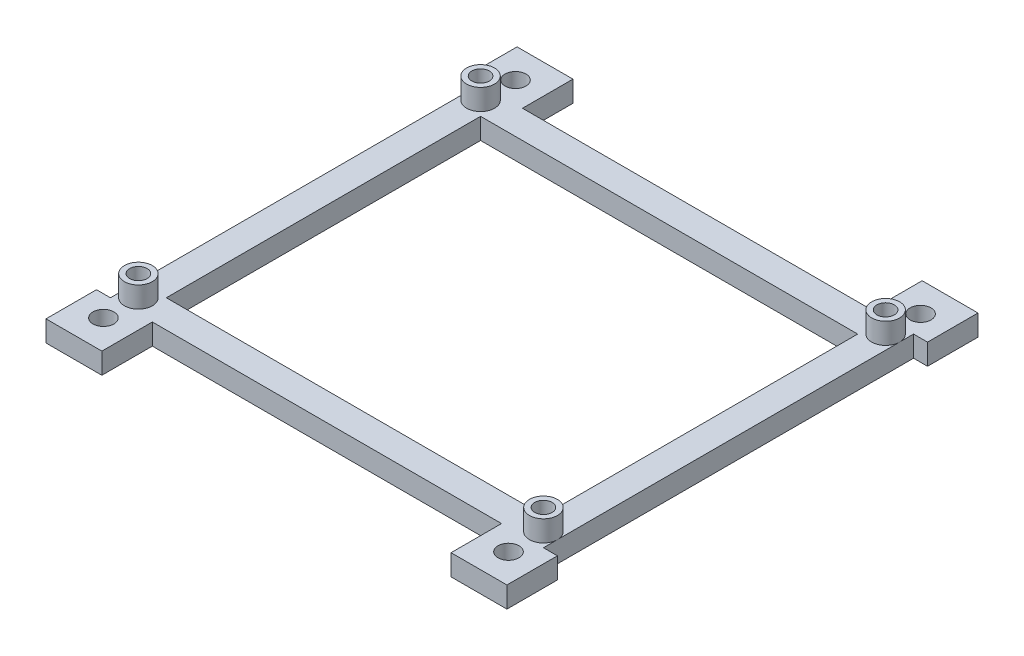
from build123d import *
from build123d.topology import SkipClean

# Parameters (mm, degrees)
SKETCH_1_R      = 2
SKETCH_1_R_2    = 1.25
EXTRUDE_1_DEPTH = 3
SKETCH_2_R      = 2
SKETCH_2_R_2    = 1.25
EXTRUDE_2_DEPTH = 3
SKETCH_3_R      = 1.5
EXTRUDE_3_DEPTH = 3
EXTRUDE_4_DEPTH = 3


with BuildPart() as part:
    # 草图1 → 凸台-拉伸1 (new body)
    # profile 1 of 12: a face of its own
    with BuildSketch(Plane(origin=(0, 0, 0), x_dir=(1, 0, 0), z_dir=(0, 1, 0))):
        with BuildLine():
            ThreePointArc((-27, -24.5), (-27.585786438, -25.914213562), (-29, -26.5))
            Line((-29, -26.5), (29, -26.5))
            ThreePointArc((29, -26.5), (27.585786438, -25.914213562), (27, -24.5))
            Line((27, -24.5), (27, -22.5))
            Line((27, -22.5), (-27, -22.5))
            Line((-27, -22.5), (-27, -24.5))
        make_face()
    # profile 2 of 12: a face of its own
    with BuildSketch(Plane(origin=(0, 0, 0), x_dir=(1, 0, 0), z_dir=(0, 1, 0))):
        with BuildLine():
            Line((29, -22.5), (27, -22.5))
            Line((27, -22.5), (27, -24.5))
            ThreePointArc((27, -24.5), (27.585786438, -23.085786438), (29, -22.5))
        make_face()
    # profile 3 of 12: a face of its own
    with BuildSketch(Plane(origin=(0, 0, 0), x_dir=(1, 0, 0), z_dir=(0, 1, 0))):
        with Locations((29, -24.5)):
            Circle(SKETCH_1_R)
        with Locations(Location((29, -24.5, 0), (0, 0, 270))):
            Circle(SKETCH_1_R_2, mode=Mode.SUBTRACT)
    # profile 4 of 12: a face of its own
    with BuildSketch(Plane(origin=(0, 0, 0), x_dir=(1, 0, 0), z_dir=(0, 1, 0))):
        with BuildLine():
            Line((31, -24.5), (31, 24.5))
            ThreePointArc((31, 24.5), (30.414213562, 23.085786438), (29, 22.5))
            Line((29, 22.5), (27, 22.5))
            Line((27, 22.5), (27, -22.5))
            Line((27, -22.5), (29, -22.5))
            ThreePointArc((29, -22.5), (30.414213562, -23.085786438), (31, -24.5))
        make_face()
    # profile 5 of 12: a face of its own
    with BuildSketch(Plane(origin=(0, 0, 0), x_dir=(1, 0, 0), z_dir=(0, 1, 0))):
        with BuildLine():
            ThreePointArc((-29, 22.5), (-30.414213562, 23.085786438), (-31, 24.5))
            Line((-31, 24.5), (-31, -24.5))
            ThreePointArc((-31, -24.5), (-30.414213562, -23.085786438), (-29, -22.5))
            Line((-29, -22.5), (-27, -22.5))
            Line((-27, -22.5), (-27, 22.5))
            Line((-27, 22.5), (-29, 22.5))
        make_face()
    # profile 6 of 12: a face of its own
    with BuildSketch(Plane(origin=(0, 0, 0), x_dir=(1, 0, 0), z_dir=(0, 1, 0))):
        with Locations((-29, -24.5)):
            Circle(SKETCH_1_R)
        with Locations(Location((-29, -24.5, 0), (0, 0, 270))):
            Circle(SKETCH_1_R_2, mode=Mode.SUBTRACT)
    # profile 7 of 12: a face of its own
    with BuildSketch(Plane(origin=(0, 0, 0), x_dir=(1, 0, 0), z_dir=(0, 1, 0))):
        with BuildLine():
            Line((-27, -22.5), (-29, -22.5))
            ThreePointArc((-29, -22.5), (-27.585786438, -23.085786438), (-27, -24.5))
            Line((-27, -24.5), (-27, -22.5))
        make_face()
    # profile 8 of 12: a face of its own
    with BuildSketch(Plane(origin=(0, 0, 0), x_dir=(1, 0, 0), z_dir=(0, 1, 0))):
        with BuildLine():
            ThreePointArc((29, 22.5), (27.585786438, 23.085786438), (27, 24.5))
            Line((27, 24.5), (27, 22.5))
            Line((27, 22.5), (29, 22.5))
        make_face()
    # profile 9 of 12: a face of its own
    with BuildSketch(Plane(origin=(0, 0, 0), x_dir=(1, 0, 0), z_dir=(0, 1, 0))):
        with Locations((29, 24.5)):
            Circle(SKETCH_1_R)
        with Locations(Location((29, 24.5, 0), (0, 0, 270))):
            Circle(SKETCH_1_R_2, mode=Mode.SUBTRACT)
    # profile 10 of 12: a face of its own
    with BuildSketch(Plane(origin=(0, 0, 0), x_dir=(1, 0, 0), z_dir=(0, 1, 0))):
        with BuildLine():
            Line((29, 26.5), (-29, 26.5))
            ThreePointArc((-29, 26.5), (-27.585786438, 25.914213562), (-27, 24.5))
            Line((-27, 24.5), (-27, 22.5))
            Line((-27, 22.5), (27, 22.5))
            Line((27, 22.5), (27, 24.5))
            ThreePointArc((27, 24.5), (27.585786438, 25.914213562), (29, 26.5))
        make_face()
    # profile 11 of 12: a face of its own
    with BuildSketch(Plane(origin=(0, 0, 0), x_dir=(1, 0, 0), z_dir=(0, 1, 0))):
        with BuildLine():
            ThreePointArc((-27, 24.5), (-27.585786438, 23.085786438), (-29, 22.5))
            Line((-29, 22.5), (-27, 22.5))
            Line((-27, 22.5), (-27, 24.5))
        make_face()
    # profile 12 of 12: a face of its own
    with BuildSketch(Plane(origin=(0, 0, 0), x_dir=(1, 0, 0), z_dir=(0, 1, 0))):
        with Locations((-29, 24.5)):
            Circle(SKETCH_1_R)
        with Locations(Location((-29, 24.5, 0), (0, 0, 270))):
            Circle(SKETCH_1_R_2, mode=Mode.SUBTRACT)
    extrude(amount=EXTRUDE_1_DEPTH)

    # 草图2 → 凸台-拉伸2 (add)
    # profile 1 of 4: a face of its own
    with SkipClean():  # the faces are left unmerged after this step: merging them gives an invalid solid
        with BuildSketch(Plane(origin=(0, 3, 0), x_dir=(1, 0, 0), z_dir=(0, 1, 0))):
            with Locations(Location((-29, 24.5, 0), (0, 0, 90))):
                Circle(SKETCH_2_R)
            with Locations(Location((-29, 24.5, 0), (0, 0, 270))):
                Circle(SKETCH_2_R_2, mode=Mode.SUBTRACT)
        # profile 2 of 4: a face of its own
        with BuildSketch(Plane(origin=(0, 3, 0), x_dir=(1, 0, 0), z_dir=(0, 1, 0))):
            with Locations(Location((29, 24.5, 0), (0, 0, 90))):
                Circle(SKETCH_2_R)
            with Locations(Location((29, 24.5, 0), (0, 0, 270))):
                Circle(SKETCH_2_R_2, mode=Mode.SUBTRACT)
        # profile 3 of 4: a face of its own
        with BuildSketch(Plane(origin=(0, 3, 0), x_dir=(1, 0, 0), z_dir=(0, 1, 0))):
            with Locations(Location((-29, -24.5, 0), (0, 0, 270))):
                Circle(SKETCH_2_R)
            with Locations(Location((-29, -24.5, 0), (0, 0, 270))):
                Circle(SKETCH_2_R_2, mode=Mode.SUBTRACT)
        # profile 4 of 4: a face of its own
        with BuildSketch(Plane(origin=(0, 3, 0), x_dir=(1, 0, 0), z_dir=(0, 1, 0))):
            with Locations(Location((29, -24.5, 0), (0, 0, 270))):
                Circle(SKETCH_2_R)
            with Locations(Location((29, -24.5, 0), (0, 0, 270))):
                Circle(SKETCH_2_R_2, mode=Mode.SUBTRACT)
        extrude(amount=EXTRUDE_2_DEPTH)

    # 草图3 → 凸台-拉伸3 (add)
    # profile 1 of 4: a face of its own
    with BuildSketch(Plane.XZ):
        with BuildLine():
            Line((-31, 24.5), (-31, 31.727166486))
            Line((-31, 31.727166486), (-27, 31.727166486))
            Line((-27, 31.727166486), (-27, 26.5))
            Line((-27, 26.5), (-29, 26.5))
            ThreePointArc((-29, 26.5), (-30.414213562, 25.914213562), (-31, 24.5))
        make_face()
        with Locations(Location((-29, 29.5, 0), (0, 0, 270))):
            Circle(SKETCH_3_R, mode=Mode.SUBTRACT)
    # profile 2 of 4: a face of its own
    with BuildSketch(Plane.XZ):
        with BuildLine():
            Line((29, 26.5), (27, 26.5))
            Line((27, 26.5), (27, 31.727166486))
            Line((27, 31.727166486), (31, 31.727166486))
            Line((31, 31.727166486), (31, 24.5))
            ThreePointArc((31, 24.5), (30.414213562, 25.914213562), (29, 26.5))
        make_face()
        with Locations(Location((29, 29.5, 0), (0, 0, 90))):
            Circle(SKETCH_3_R, mode=Mode.SUBTRACT)
    # profile 3 of 4: a face of its own
    with BuildSketch(Plane.XZ):
        with BuildLine():
            Line((31, -24.5), (31, -31.727166486))
            Line((31, -31.727166486), (27, -31.727166486))
            Line((27, -31.727166486), (27, -26.5))
            Line((27, -26.5), (29, -26.5))
            ThreePointArc((29, -26.5), (30.414213562, -25.914213562), (31, -24.5))
        make_face()
        with Locations(Location((29, -29.5, 0), (0, 0, 270))):
            Circle(SKETCH_3_R, mode=Mode.SUBTRACT)
    # profile 4 of 4: a face of its own
    with BuildSketch(Plane.XZ):
        with BuildLine():
            Line((-29, -26.5), (-27, -26.5))
            Line((-27, -26.5), (-27, -31.727166486))
            Line((-27, -31.727166486), (-31, -31.727166486))
            Line((-31, -31.727166486), (-31, -24.5))
            ThreePointArc((-31, -24.5), (-30.414213562, -25.914213562), (-29, -26.5))
        make_face()
        with Locations(Location((-29, -29.5, 0), (0, 0, 90))):
            Circle(SKETCH_3_R, mode=Mode.SUBTRACT)
    extrude(amount=-EXTRUDE_3_DEPTH)

    # 草图4 → 凸台-拉伸4 (add)
    with BuildSketch(Plane.XZ):
        Polygon((-31, 26.5), (-33, 26.5), (-33, 31.727166486), (-33, 33.727166486), (-25, 33.727166486), (-25, 26.5), (-27, 26.5), (-27, 31.727166486), (-31, 31.727166486), align=None)
        Polygon((27, 31.727166486), (27, 26.5), (25, 26.5), (25, 33.727166486), (33, 33.727166486), (33, 31.727166486), (33, 26.5), (31, 26.5), (31, 31.727166486), align=None)
        Polygon((31, -26.5), (33, -26.5), (33, -31.727166486), (33, -33.727166486), (25, -33.727166486), (25, -26.5), (27, -26.5), (27, -31.727166486), (31, -31.727166486), align=None)
        Polygon((-27, -31.727166486), (-27, -26.5), (-25, -26.5), (-25, -33.727166486), (-33, -33.727166486), (-33, -31.727166486), (-33, -26.5), (-31, -26.5), (-31, -31.727166486), align=None)
    extrude(amount=-EXTRUDE_4_DEPTH)


solid = part.part
